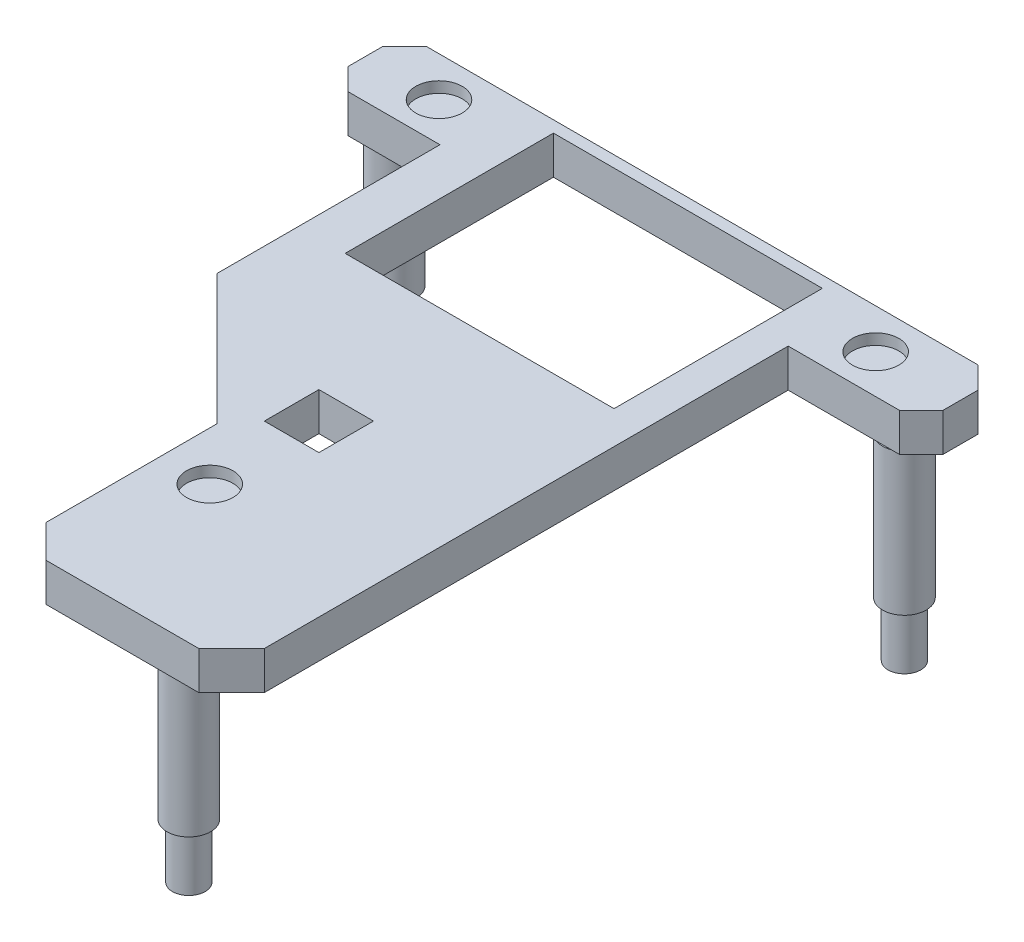
from build123d import *

# Parameters (mm, degrees)
SKETCH4_W           = 24.633837396
SKETCH4_H           = 19.082768461
SKETCH4_W_2         = 5
SKETCH4_H_2         = 5
MAINBRACKET_DEPTH   = 3.5
SKETCH3_R           = 2
BOSS_EXTRUDE2_DEPTH = 13
SKETCH6_R           = 1.5
BOSS_EXTRUDE3_DEPTH = 5
SKETCH7_R           = 2.125
CUT_EXTRUDE1_DEPTH  = 1


with BuildPart() as part:
    # Sketch4 → MainBracket (new body)
    with BuildSketch(Plane(origin=(0, 0, 0), x_dir=(1, 0, 0), z_dir=(0, 1, 0))):
        Polygon((-25.001052975, 23.597895529), (25.52718448, 23.597895529), (27.52718448, 21.597895529), (27.52718448, 18.397895529), (25.52718448, 16.397895529), (15.338231538, 16.397895529), (15.338231538, -31.590979949), (12.338231538, -34.590979949), (-1.661768462, -34.590979949), (-4.661768462, -31.590979949), (-4.661768462, -15.921260677), (-16.583029139, -4), (-16.583029139, 16.421906692), (-25.001052975, 16.421906692), (-27.001052975, 18.421906692), (-27.001052975, 21.597895529), align=None)
        with Locations((0.008956485, 13.000441896)):
            Rectangle(SKETCH4_W, SKETCH4_H, mode=Mode.SUBTRACT)
        with Locations((-0.204070078, -11.047717724)):
            Rectangle(SKETCH4_W_2, SKETCH4_H_2, mode=Mode.SUBTRACT)
    extrude(amount=MAINBRACKET_DEPTH)

    # Sketch3 → Boss-Extrude2 (add)
    with BuildSketch(Plane(origin=(0, 0, 0), x_dir=(1, 0, 0), z_dir=(0, 1, 0))):
        with Locations((-24.011269627, 19.663273311)):
            Circle(SKETCH3_R)
        with Locations((24.107482847, 18.27469294)):
            Circle(SKETCH3_R)
        with Locations((8.917908931, -32.088026328)):
            Circle(SKETCH3_R)
    extrude(amount=-BOSS_EXTRUDE2_DEPTH)

    # Sketch6 → Boss-Extrude3 (add)
    with BuildSketch(Plane.XZ.offset(13)):
        with Locations((-24.011269627, -19.663273311)):
            Circle(SKETCH6_R)
        with Locations((8.917908931, 32.088026328)):
            Circle(SKETCH6_R)
        with Locations((24.107482847, -18.27469294)):
            Circle(SKETCH6_R)
    extrude(amount=BOSS_EXTRUDE3_DEPTH)

    # Sketch7 → Cut-Extrude1 (cut)
    with BuildSketch(Plane(origin=(0, 3.5, 0), x_dir=(1, 0, 0), z_dir=(0, 1, 0))):
        with Locations((-0.204070078, -21.047717724)):
            Circle(SKETCH7_R)
        with Locations((-20.204070078, 19.952282276)):
            Circle(SKETCH7_R)
        with Locations((19.795929922, 19.952282276)):
            Circle(SKETCH7_R)
    extrude(amount=-CUT_EXTRUDE1_DEPTH, mode=Mode.SUBTRACT)


solid = part.part
